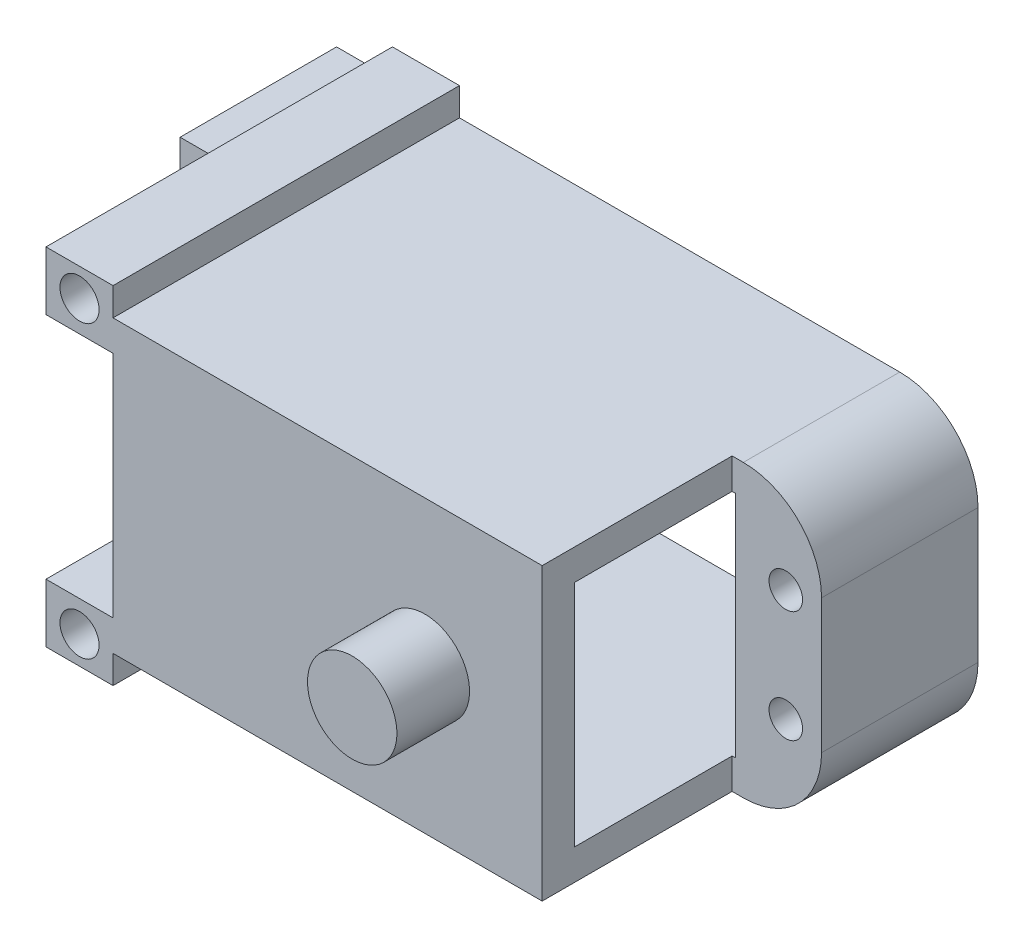
from build123d import *

# Parameters (mm, degrees)
SKETCH_1_W                  = 57.4
SKETCH_1_H                  = 28.5
EXTRUDE_1_DEPTH             = 12
SKETCH_2_W                  = 57.4
SKETCH_2_H                  = 26
EXTRUDE_2_DEPTH             = 19
SKETCH_3_W                  = 16.1
SKETCH_3_H                  = 20.5
CUT_EXTRUDE_1_DEPTH         = 7.7
SKETCH_4_W                  = 28.1
SKETCH_4_H                  = 20.5
CUT_EXTRUDE_2_DEPTH         = 41.7
SKETCH_5_W                  = 31
SKETCH_5_H                  = 20.5
CUT_EXTRUDE_3_DEPTH         = 0.3
CUT_EXTRUDE_4_DEPTH         = 2.9
SKETCH_7_W                  = 12
SKETCH_7_H                  = 2.5
CUT_EXTRUDE_5_DEPTH         = 46.4
CUT_EXTRUDE_6_DEPTH         = 7.7
CUT_EXTRUDE_7_DEPTH         = 14.1
CUT_EXTRUDE_8_DEPTH         = 3.3
SKETCH_11_W                 = 11
SKETCH_11_H                 = 12
EXTRUDE_3_DEPTH             = 2.5
SKETCH_12_W                 = 12
SKETCH_12_H                 = 2.75
EXTRUDE_4_DEPTH             = 6
SKETCH_13_W                 = 6
SKETCH_13_H                 = 12
EXTRUDE_5_DEPTH             = 2.5
SKETCH_14_W                 = 12
SKETCH_14_H                 = 5.25
EXTRUDE_6_DEPTH             = 6
SKETCH_15_W                 = 5
SKETCH_15_H                 = 2.5
CUT_EXTRUDE_9_DEPTH         = 45.999333328
SKETCH_16_W                 = 5
SKETCH_16_H                 = 2.5
CUT_EXTRUDE_10_DEPTH        = 45.999333328
SKETCH_17_W                 = 5
SKETCH_17_H                 = 26
EXTRUDE_7_DEPTH             = 2
SKETCH_18_W                 = 10
SKETCH_18_H                 = 6
EXTRUDE_8_DEPTH             = 7
SKETCH_19_W                 = 4
SKETCH_19_H                 = 6.5
HOLE_WIZARD_3_5_3_5_1_D     = 3.5
HOLE_WIZARD_3_5_3_5_1_DEPTH = 12
HOLE_WIZARD_3_5_3_5_2_D     = 3.5
HOLE_WIZARD_3_0_3_3_D       = 3
HOLE_WIZARD_3_0_3_3_DEPTH   = 37.5
HOLE_WIZARD_3_5_3_5_3_D     = 3.5
FILLET_1_R                  = 7
EXTRUDE_START               = -19
SKETCH_28_W                 = 6
SKETCH_28_H                 = 5.25
SKETCH_28_R                 = 1.75
EXTRUDE_9_DEPTH             = 7


with BuildPart() as part:
    # Эскиз1 → Бобышка-Вытянуть1 (new body)
    with BuildSketch(Plane.XY.offset(12)):
        with Locations((0, 1.25)):
            Rectangle(SKETCH_1_W, SKETCH_1_H)
    extrude(amount=-EXTRUDE_1_DEPTH)

    # Эскиз2 → Бобышка-Вытянуть2 (add)
    with BuildSketch(Plane.XY.offset(12)):
        Rectangle(SKETCH_2_W, SKETCH_2_H)
    extrude(amount=EXTRUDE_2_DEPTH)

    # Эскиз3 → Вырез-Вытянуть1 (cut)
    with BuildSketch(Plane.ZY.offset(28.7)):
        with Locations((20.05, 0)):
            Rectangle(SKETCH_3_W, SKETCH_3_H)
    extrude(amount=-CUT_EXTRUDE_1_DEPTH, mode=Mode.SUBTRACT)

    # Эскиз4 → Вырез-Вытянуть2 (cut)
    with BuildSketch(Plane.ZY.offset(21)):
        with Locations((14.05, 0)):
            Rectangle(SKETCH_4_W, SKETCH_4_H)
    extrude(amount=-CUT_EXTRUDE_2_DEPTH, mode=Mode.SUBTRACT)

    # Эскиз5 → Вырез-Вытянуть3 (cut)
    with BuildSketch(Plane.ZY.offset(-20.7)):
        with Locations((15.5, 0)):
            Rectangle(SKETCH_5_W, SKETCH_5_H)
    extrude(amount=-CUT_EXTRUDE_3_DEPTH, mode=Mode.SUBTRACT)

    # Эскиз6 → Вырез-Вытянуть4 (cut)
    with BuildSketch(Plane.XY.offset(31)):
        Polygon((28.7, -13), (28.7, 13), (20.7, 13), (20.7, 10.25), (21, 10.25), (21, -10.25), (20.7, -10.25), (20.7, -13), align=None)
    extrude(amount=-CUT_EXTRUDE_4_DEPTH, mode=Mode.SUBTRACT)

    # Эскиз7 → Вырез-Вытянуть5 (cut)
    with BuildSketch(Plane(origin=(28.7, 0, 0), x_dir=(0, 0, -1), z_dir=(1, 0, 0))):
        with Locations((-6, 14.25)):
            Rectangle(SKETCH_7_W, SKETCH_7_H)
    extrude(amount=-CUT_EXTRUDE_5_DEPTH, mode=Mode.SUBTRACT)

    # Эскиз8 → Вырез-Вытянуть6 (cut)
    with BuildSketch(Plane.ZY.offset(28.7)):
        Polygon((12, -13), (31, -13), (31, 13), (12, 13), (12, 10.25), (28.1, 10.25), (28.1, -10.25), (12, -10.25), align=None)
    extrude(amount=-CUT_EXTRUDE_6_DEPTH, mode=Mode.SUBTRACT)

    # Эскиз9 → Вырез-Вытянуть7 (cut)
    with BuildSketch(Plane.XY.offset(28.1)):
        Polygon((28.7, -13), (28.7, 13), (20.7, 13), (20.7, 10.25), (21, 10.25), (21, -10.25), (20.7, -10.25), (20.7, -13), align=None)
    extrude(amount=-CUT_EXTRUDE_7_DEPTH, mode=Mode.SUBTRACT)

    # Эскиз10 → Вырез-Вытянуть8 (cut)
    with BuildSketch(Plane.ZY.offset(21)):
        Polygon((12, -13), (31, -13), (31, 13), (12, 13), (12, 10.25), (28.1, 10.25), (28.1, -10.25), (12, -10.25), align=None)
    extrude(amount=-CUT_EXTRUDE_8_DEPTH, mode=Mode.SUBTRACT)

    # Эскиз11 → Бобышка-Вытянуть3 (add)
    with BuildSketch(Plane.XZ.offset(13)):
        with Locations((-23.2, 6)):
            Rectangle(SKETCH_11_W, SKETCH_11_H)
    extrude(amount=EXTRUDE_3_DEPTH)

    # Эскиз12 → Бобышка-Вытянуть4 (add)
    with BuildSketch(Plane.ZY.offset(17.7)):
        with Locations((25, -11.625)):
            Rectangle(SKETCH_12_W, SKETCH_12_H)
    extrude(amount=EXTRUDE_4_DEPTH)

    # Эскиз13 → Бобышка-Вытянуть5 (add)
    with BuildSketch(Plane.XZ.offset(13)):
        with Locations((-20.7, 25)):
            Rectangle(SKETCH_13_W, SKETCH_13_H)
    extrude(amount=EXTRUDE_5_DEPTH)

    # Эскиз14 → Бобышка-Вытянуть6 (add)
    with BuildSketch(Plane.ZY.offset(17.7)):
        with Locations((25, 12.875)):
            Rectangle(SKETCH_14_W, SKETCH_14_H)
    extrude(amount=EXTRUDE_6_DEPTH)

    # Эскиз15 → Вырез-Вытянуть9 (cut, through all)
    with BuildSketch(Plane(origin=(0, 0, 0), x_dir=(-1, 0, 0), z_dir=(0, 0, -1))):
        with Locations((26.2, -14.25)):
            Rectangle(SKETCH_15_W, SKETCH_15_H)
    extrude(amount=-CUT_EXTRUDE_9_DEPTH, mode=Mode.SUBTRACT)

    # Эскиз16 → Вырез-Вытянуть10 (cut, through all)
    with BuildSketch(Plane(origin=(0, 0, 0), x_dir=(-1, 0, 0), z_dir=(0, 0, -1))):
        with Locations((26.2, 14.25)):
            Rectangle(SKETCH_16_W, SKETCH_16_H)
    extrude(amount=-CUT_EXTRUDE_10_DEPTH, mode=Mode.SUBTRACT)

    # Эскиз17 → Бобышка-Вытянуть7 (add)
    with BuildSketch(Plane.XY.offset(12)):
        with Locations((-26.2, 0)):
            Rectangle(SKETCH_17_W, SKETCH_17_H)
    extrude(amount=EXTRUDE_7_DEPTH)

    # Эскиз18 → Бобышка-Вытянуть8 (add)
    with BuildSketch(Plane.ZY.offset(28.7)):
        with Locations((5, 0)):
            Rectangle(SKETCH_18_W, SKETCH_18_H)
    extrude(amount=EXTRUDE_8_DEPTH)

    # Эскиз19 → Повернуть1 (revolve)
    with BuildSketch(Plane.XZ, mode=Mode.PRIVATE) as revolve_1_sk:
        with Locations((12.2, 34.25)):
            Rectangle(SKETCH_19_W, SKETCH_19_H)
    revolve(revolve_1_sk.sketch.rotate(Axis((10.2, 0, 37.5), (0, 0, -1)), 180), axis=Axis((10.2, 0, 37.5), (0, 0, -1)))

    # Диаметр отверстия Ø3.5 (3.5)1
    with Locations(Plane.XY.offset(31)):
        with Locations((-20.7, 13), (-20.7, -13)):
            Hole(HOLE_WIZARD_3_5_3_5_1_D / 2, depth=HOLE_WIZARD_3_5_3_5_1_DEPTH)

    # Диаметр отверстия Ø3.5 (3.5)2 (through all)
    with Locations(Plane(origin=(0, 0, 0), x_dir=(-1, 0, 0), z_dir=(0, 0, -1))):
        with Locations((32.7, 0)):
            Hole(HOLE_WIZARD_3_5_3_5_2_D / 2)

    # Диаметр отверстия Ø3.0 (3)3
    with Locations(Plane(origin=(0, 0, 0), x_dir=(-1, 0, 0), z_dir=(0, 0, -1))):
        with Locations((-25.5, -5), (-25.5, 5), (25.5, -5), (25.5, 5)):
            Hole(HOLE_WIZARD_3_0_3_3_D / 2, depth=HOLE_WIZARD_3_0_3_3_DEPTH)

    # Диаметр отверстия Ø3.5 (3.5)3 (through all)
    with Locations(Plane.XY.offset(12)):
        with Locations((-20.7, 13), (-20.7, -13)):
            Hole(HOLE_WIZARD_3_5_3_5_3_D / 2)

    # Скругление1
    fillet_1_edges = [part.edges().sort_by_distance(p)[0] for p in [
        (28.7, 13, 7),
        (28.7, -13, 7),
    ]]
    fillet(fillet_1_edges, radius=FILLET_1_R)

    # Эскиз28 → Бобышка-Вытянуть9 (add)
    # profile 1 of 2: a face of its own
    with BuildSketch(Plane.XY.offset(31).offset(EXTRUDE_START)):
        with Locations((-20.7, 12.875)):
            Rectangle(SKETCH_28_W, SKETCH_28_H)
        with Locations((-20.7, 13)):
            Circle(SKETCH_28_R, mode=Mode.SUBTRACT)
    # profile 2 of 2: a face of its own
    with BuildSketch(Plane.XY.offset(31).offset(EXTRUDE_START)):
        with Locations((-20.7, -12.875)):
            Rectangle(SKETCH_28_W, SKETCH_28_H)
        with Locations((-20.7, -13)):
            Circle(SKETCH_28_R, mode=Mode.SUBTRACT)
    extrude(amount=EXTRUDE_9_DEPTH)


solid = part.part
